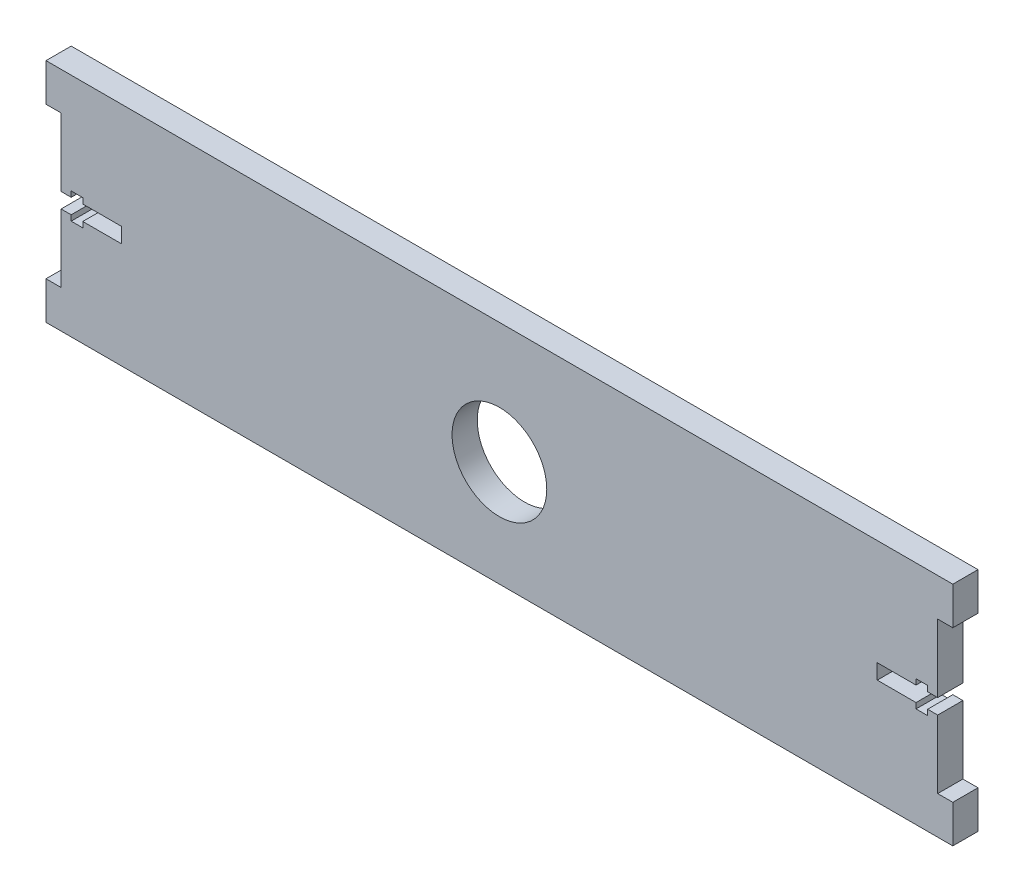
from build123d import *

# Parameters (mm, degrees)
ESQUISSE1_R        = 9.4
BOSS_EXTRU_1_DEPTH = 5


with BuildPart() as part:
    # Esquisse1 → Boss.-Extru.1 (new body)
    with BuildSketch(Plane.XY):
        Polygon((90, 45), (34.5, 45), (-34.5, 45), (-90, 45), (-90, 37.5), (-87, 37.5), (-87, 24), (-85, 24), (-85, 25.1), (-82.7, 25.1), (-82.7, 24), (-75, 24), (-75, 21), (-82.7, 21), (-82.7, 19.9), (-85, 19.9), (-85, 21), (-87, 21), (-87, 7.5), (-90, 7.5), (-90, 0), (90, 0), (90, 7.5), (87, 7.5), (87, 21), (85, 21), (85, 19.9), (82.7, 19.9), (82.7, 21), (75, 21), (75, 24), (82.7, 24), (82.7, 25.1), (85, 25.1), (85, 24), (87, 24), (87, 37.5), (90, 37.5), align=None)
        with Locations((0, 21)):
            Circle(ESQUISSE1_R, mode=Mode.SUBTRACT)
    extrude(amount=BOSS_EXTRU_1_DEPTH)


solid = part.part
